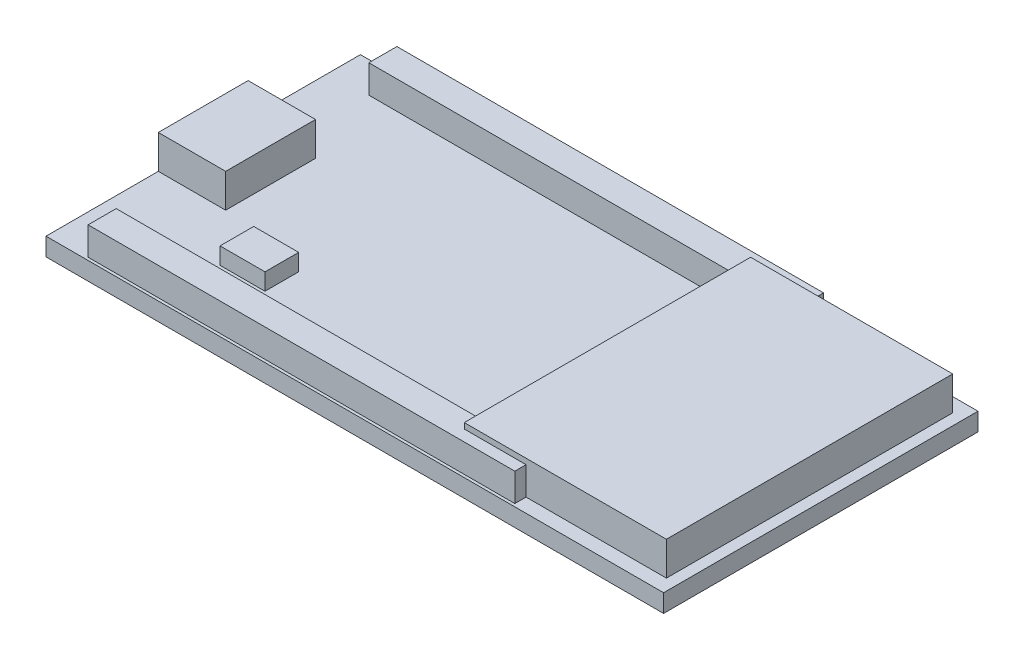
from build123d import *

# Parameters (mm, degrees)
SKETCH1_W          = 55
SKETCH1_H          = 28
PCB_DEPTH          = 1.6
WROOM_SHIELD_START = 1.6
SKETCH2_W          = 18
SKETCH2_H          = 25.5
WROOM_SHIELD_DEPTH = 3
MICRO_USB_START    = 1.6
SKETCH3_W          = 6
SKETCH3_H          = 8
MICRO_USB_DEPTH    = 3
HEADER_1_START     = 1.6
SKETCH4_W          = 38
SKETCH4_H          = 2.5
HEADER_1_DEPTH     = 2.5
HEADER_2_START     = 1.6
SKETCH5_W          = 38
SKETCH5_H          = 2.5
HEADER_2_DEPTH     = 2.5
BUTTON_EN_START    = 1.6
SKETCH6_W          = 4
SKETCH6_H          = 3
BUTTON_EN_DEPTH    = 1.5


with BuildPart() as part:
    # Sketch1 → PCB (new body)
    with BuildSketch(Plane(origin=(0, 0, 0), x_dir=(1, 0, 0), z_dir=(0, 1, 0))):
        Rectangle(SKETCH1_W, SKETCH1_H)
    extrude(amount=PCB_DEPTH)

    # Sketch2 → WROOM_Shield (add)
    with BuildSketch(Plane(origin=(0, 0, 0), x_dir=(1, 0, 0), z_dir=(0, 1, 0)).offset(WROOM_SHIELD_START)):
        with Locations((17.5, 0)):
            Rectangle(SKETCH2_W, SKETCH2_H)
    extrude(amount=WROOM_SHIELD_DEPTH)

    # Sketch3 → Micro_USB (add)
    with BuildSketch(Plane(origin=(0, 0, 0), x_dir=(1, 0, 0), z_dir=(0, 1, 0)).offset(MICRO_USB_START)):
        with Locations((-24.5, 0)):
            Rectangle(SKETCH3_W, SKETCH3_H)
    extrude(amount=MICRO_USB_DEPTH)

    # Sketch4 → Header_1 (add)
    with BuildSketch(Plane(origin=(0, 0, 0), x_dir=(1, 0, 0), z_dir=(0, 1, 0)).offset(HEADER_1_START)):
        with Locations((-5, -12.5)):
            Rectangle(SKETCH4_W, SKETCH4_H)
    extrude(amount=HEADER_1_DEPTH)

    # Sketch5 → Header_2 (add)
    with BuildSketch(Plane(origin=(0, 0, 0), x_dir=(1, 0, 0), z_dir=(0, 1, 0)).offset(HEADER_2_START)):
        with Locations((-5, 12.5)):
            Rectangle(SKETCH5_W, SKETCH5_H)
    extrude(amount=HEADER_2_DEPTH)

    # Sketch6 → Button_EN (add)
    with BuildSketch(Plane(origin=(0, 0, 0), x_dir=(1, 0, 0), z_dir=(0, 1, 0)).offset(BUTTON_EN_START)):
        with Locations((-15.5, -7)):
            Rectangle(SKETCH6_W, SKETCH6_H)
    extrude(amount=BUTTON_EN_DEPTH)


solid = part.part
